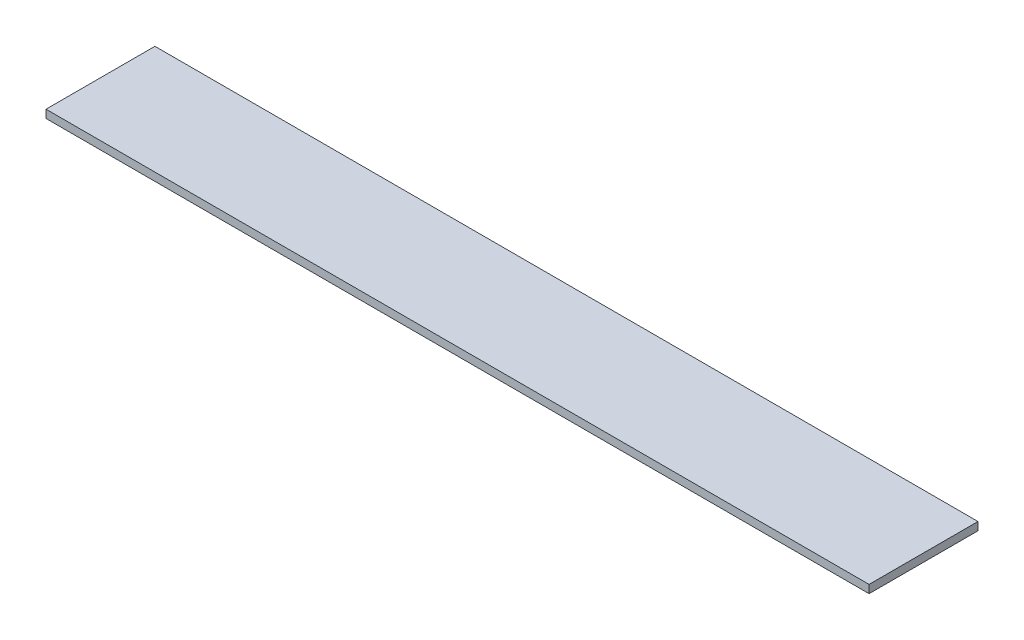
from build123d import *

# Parameters (mm, degrees)
SKETCH_1_W      = 612
SKETCH_1_H      = 81
EXTRUDE_1_DEPTH = 6


with BuildPart() as part:
    # Эскиз1 → Бобышка-Вытянуть1 (new body)
    with BuildSketch(Plane(origin=(0, 0, 0), x_dir=(1, 0, 0), z_dir=(0, 1, 0))):
        with Locations((300, 415.5)):
            Rectangle(SKETCH_1_W, SKETCH_1_H)
    extrude(amount=EXTRUDE_1_DEPTH)


solid = part.part
